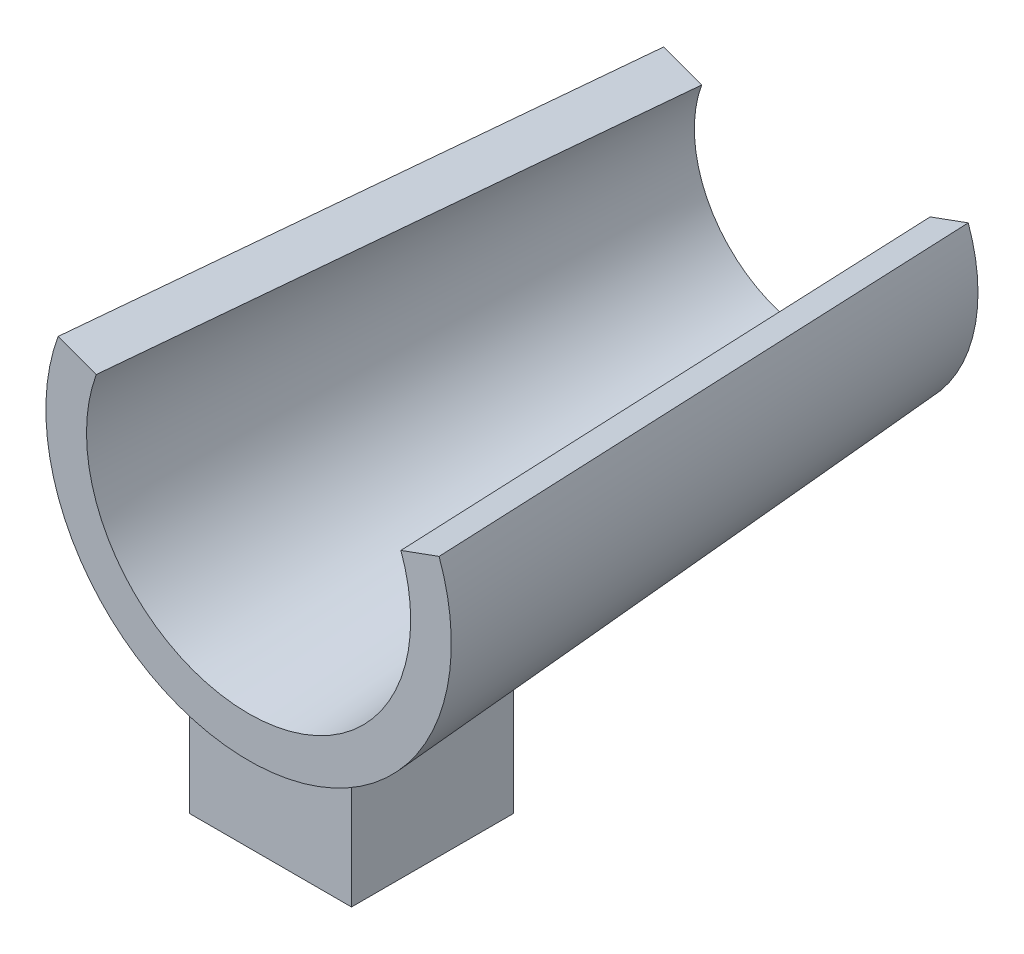
from build123d import *

# Parameters (mm, degrees)
REVOLVE1_ANGLE                  = 200
REVOLVE1_OTHER_WAY_ANGLE        = 20
BOSS_EXTRUDE1_REACH             = 140.597
SKETCH2_W                       = 50.8
SKETCH2_H                       = 50.8
BOSS_EXTRUDE1_DIRECTION_2_DEPTH = 30.48


with BuildPart() as part:
    # Sketch1 → Revolve1 (revolve)
    with BuildSketch(Plane(origin=(0, 0, 0), x_dir=(1, 0, 0), z_dir=(0, 1, 0))):
        Polygon((50.8, 88.9), (63.53235674, -88.9), (50.8, -88.9), (38.1, 88.9), align=None)
    revolve(axis=Axis((0, 0, 0), (0, 0, -1)), revolution_arc=REVOLVE1_ANGLE)

    # Sketch1 → Revolve1 other way (revolve)
    with BuildSketch(Plane(origin=(0, 0, 0), x_dir=(1, 0, 0), z_dir=(0, 1, 0))):
        Polygon((50.8, 88.9), (63.53235674, -88.9), (50.8, -88.9), (38.1, 88.9), align=None)
    revolve(axis=Axis((0, 0, 0), (0, 0, 1)), revolution_arc=REVOLVE1_OTHER_WAY_ANGLE)

    # Boss-Extrude1: up to this cone (the profile starts outside it)
    boss_extrude1_end = Plane(origin=(0, 0, 56.646058), z_dir=(0, 0, 1)) * Cone(46.734412691, 75.710855393, 404.639268083, mode=Mode.PRIVATE)
    # Sketch2 → Boss-Extrude1 (add, up to the surface)
    with BuildSketch(Plane(origin=(0, -63.53235674, 0), x_dir=(1, 0, 0), z_dir=(0, 1, 0)), mode=Mode.PRIVATE) as boss_extrude1_sk1:
        with Locations((0, -56.646058408)):
            Rectangle(SKETCH2_W, SKETCH2_H)
    boss_extrude1_tool1 = extrude(boss_extrude1_sk1.sketch, amount=BOSS_EXTRUDE1_REACH, mode=Mode.PRIVATE) - boss_extrude1_end
    add(boss_extrude1_tool1.solids().sort_by_distance((0, -63.532357, 56.646058))[0])

    # Sketch2 → Boss-Extrude1 direction 2 (add)
    with BuildSketch(Plane(origin=(0, -63.53235674, 0), x_dir=(1, 0, 0), z_dir=(0, 1, 0))):
        with Locations((0, -56.646058408)):
            Rectangle(SKETCH2_W, SKETCH2_H)
    extrude(amount=-BOSS_EXTRUDE1_DIRECTION_2_DEPTH)

    # Sketch3 → Cut-Revolve2 (revolve, cut)
    with BuildSketch(Plane.XY.offset(56.646058408)):
        with BuildLine():
            Line((0, -57.830061824), (0, -98.470061824))
            ThreePointArc((0, -98.470061824), (-20.32, -78.150061824), (0, -57.830061824))
        make_face()
    revolve(axis=Axis((0, -78.150061824, 56.646058408), (0, -1, 0)), mode=Mode.SUBTRACT)


solid = part.part
